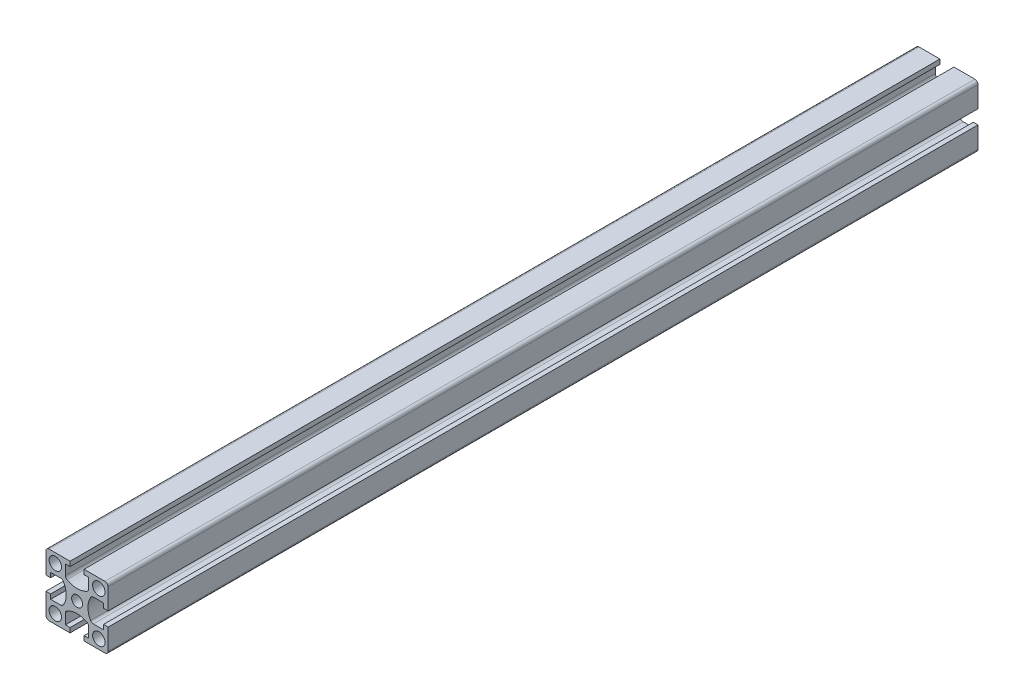
from build123d import *

# Parameters (mm, degrees)
SKETCH1_R           = 2.5
SKETCH1_R_2         = 2.1875
BOSS_EXTRUDE1_DEPTH = 350


with BuildPart() as part:
    # Sketch1 → Boss-Extrude1 (new body)
    with BuildSketch(Plane.XY):
        with BuildLine():
            Line((-12.5, 11.25), (-12.5, 2.8125))
            Line((-12.5, 2.8125), (-10.625, 2.8125))
            Line((-10.625, 2.8125), (-10.625, 4.6875))
            Line((-10.625, 4.6875), (-6.546075349, 4.6875))
            ThreePointArc((-6.546075349, 4.6875), (-5.921075349, 4.520031755), (-5.463543594, 4.0625))
            ThreePointArc((-5.463543594, 4.0625), (-4.375, 0), (-5.463543594, -4.0625))
            ThreePointArc((-5.463543594, -4.0625), (-5.921075349, -4.520031755), (-6.546075349, -4.6875))
            Line((-6.546075349, -4.6875), (-10.625, -4.6875))
            Line((-10.625, -4.6875), (-10.625, -2.8125))
            Line((-10.625, -2.8125), (-12.5, -2.8125))
            Line((-12.5, -2.8125), (-12.5, -11.25))
            ThreePointArc((-12.5, -11.25), (-12.133883476, -12.133883476), (-11.25, -12.5))
            Line((-11.25, -12.5), (-2.8125, -12.5))
            Line((-2.8125, -12.5), (-2.8125, -10.625))
            Line((-2.8125, -10.625), (-4.6875, -10.625))
            Line((-4.6875, -10.625), (-4.6875, -6.546075349))
            ThreePointArc((-4.6875, -6.546075349), (-4.520031755, -5.921075349), (-4.0625, -5.463543594))
            ThreePointArc((-4.0625, -5.463543594), (0, -4.375), (4.0625, -5.463543594))
            ThreePointArc((4.0625, -5.463543594), (4.520031755, -5.921075349), (4.6875, -6.546075349))
            Line((4.6875, -6.546075349), (4.6875, -10.625))
            Line((4.6875, -10.625), (2.8125, -10.625))
            Line((2.8125, -10.625), (2.8125, -12.5))
            Line((2.8125, -12.5), (11.25, -12.5))
            ThreePointArc((11.25, -12.5), (12.133883476, -12.133883476), (12.5, -11.25))
            Line((12.5, -11.25), (12.5, -2.8125))
            Line((12.5, -2.8125), (10.625, -2.8125))
            Line((10.625, -2.8125), (10.625, -4.6875))
            Line((10.625, -4.6875), (6.546075349, -4.6875))
            ThreePointArc((6.546075349, -4.6875), (5.921075349, -4.520031755), (5.463543594, -4.0625))
            ThreePointArc((5.463543594, -4.0625), (4.375, 0), (5.463543594, 4.0625))
            ThreePointArc((5.463543594, 4.0625), (5.921075349, 4.520031755), (6.546075349, 4.6875))
            Line((6.546075349, 4.6875), (10.625, 4.6875))
            Line((10.625, 4.6875), (10.625, 2.8125))
            Line((10.625, 2.8125), (12.5, 2.8125))
            Line((12.5, 2.8125), (12.5, 11.25))
            ThreePointArc((12.5, 11.25), (12.133883476, 12.133883476), (11.25, 12.5))
            Line((11.25, 12.5), (2.8125, 12.5))
            Line((2.8125, 12.5), (2.8125, 10.625))
            Line((2.8125, 10.625), (4.6875, 10.625))
            Line((4.6875, 10.625), (4.6875, 6.546075349))
            ThreePointArc((4.6875, 6.546075349), (4.520031755, 5.921075349), (4.0625, 5.463543594))
            ThreePointArc((4.0625, 5.463543594), (0, 4.375), (-4.0625, 5.463543594))
            ThreePointArc((-4.0625, 5.463543594), (-4.520031755, 5.921075349), (-4.6875, 6.546075349))
            Line((-4.6875, 6.546075349), (-4.6875, 10.625))
            Line((-4.6875, 10.625), (-2.8125, 10.625))
            Line((-2.8125, 10.625), (-2.8125, 12.5))
            Line((-2.8125, 12.5), (-11.25, 12.5))
            ThreePointArc((-11.25, 12.5), (-12.133883476, 12.133883476), (-12.5, 11.25))
        make_face()
        with Locations((-8.75, -8.75)):
            Circle(SKETCH1_R, mode=Mode.SUBTRACT)
        with Locations((8.75, -8.75)):
            Circle(SKETCH1_R, mode=Mode.SUBTRACT)
        with Locations((8.75, 8.75)):
            Circle(SKETCH1_R, mode=Mode.SUBTRACT)
        Circle(SKETCH1_R_2, mode=Mode.SUBTRACT)
        with Locations((-8.75, 8.75)):
            Circle(SKETCH1_R, mode=Mode.SUBTRACT)
    extrude(amount=BOSS_EXTRUDE1_DEPTH)


solid = part.part
